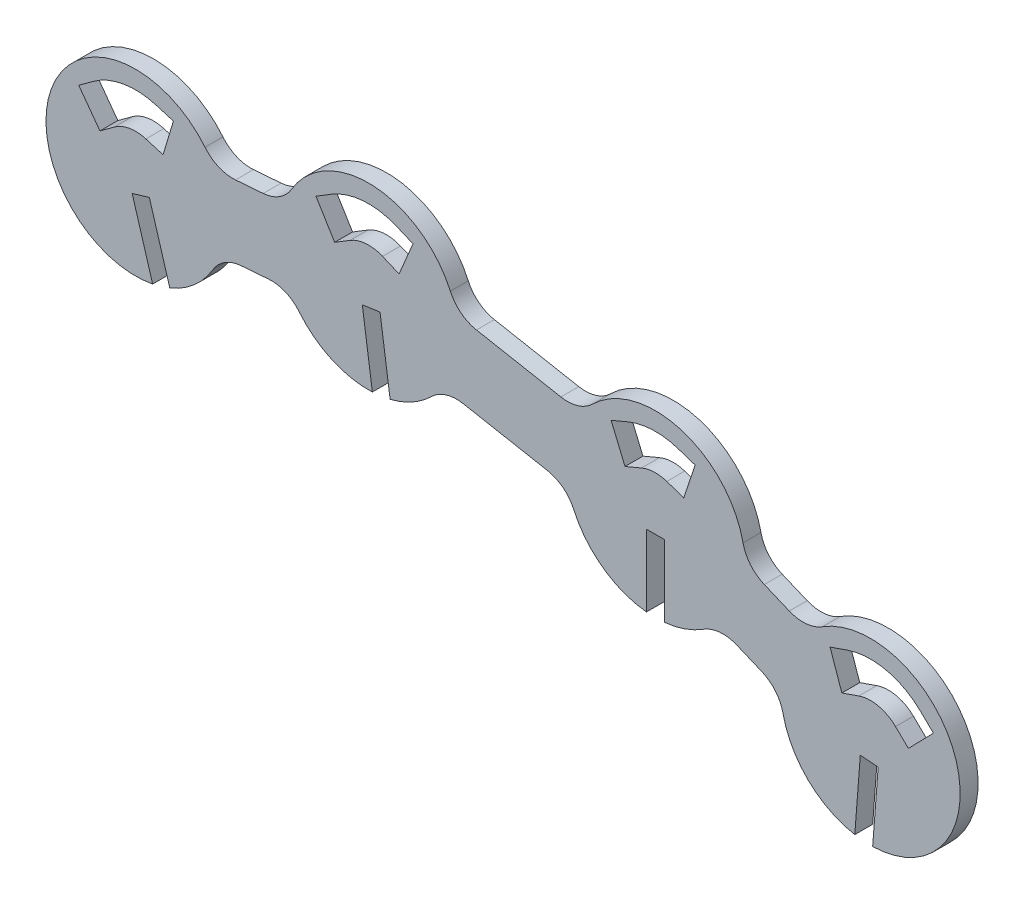
from build123d import *

# Parameters (mm, degrees)
BOSS_EXTRUDE1_DEPTH = 1.5875
FILLET1_R           = 3.175


with BuildPart() as part:
    # Sketch4 → Boss-Extrude1 (new body)
    with BuildSketch(Plane.XY):
        with BuildLine():
            Line((100.453077844, 80.395193317), (94.322399388, 79.923602666))
            ThreePointArc((94.322399388, 79.923602666), (80.150110348, 79.621122729), (88.821616455, 68.40728072))
            Line((88.821616455, 68.40728072), (87.008390154, 74.451368388))
            Line((87.008390154, 74.451368388), (87.768664768, 74.679450772))
            Line((87.768664768, 74.679450772), (88.528939382, 74.907533156))
            Line((88.528939382, 74.907533156), (90.342165683, 68.863445488))
            ThreePointArc((90.342165683, 68.863445488), (93.082490895, 70.749210028), (94.809422156, 73.592306683))
            Line((94.809422156, 73.592306683), (100.940100612, 74.063897334))
            ThreePointArc((100.940100612, 74.063897334), (104.003334801, 70.900719906), (108.281132842, 69.856910029))
            Line((108.281132842, 69.856910029), (107.388733992, 76.103701977))
            Line((107.388733992, 76.103701977), (108.174506403, 76.215955179))
            Line((108.174506403, 76.215955179), (108.960278814, 76.32820838))
            Line((108.960278814, 76.32820838), (109.852677663, 70.081416432))
            ThreePointArc((109.852677663, 70.081416432), (112.484101458, 71.272453552), (114.515120736, 73.3262114))
            Line((114.515120736, 73.3262114), (125.614647067, 71.245050213))
            ThreePointArc((125.614647067, 71.245050213), (128.101842683, 67.070106968), (132.55625, 65.127287218))
            Line((132.55625, 65.127287218), (132.55625, 71.477287218))
            Line((132.55625, 71.477287218), (133.35, 71.477287218))
            Line((133.35, 71.477287218), (134.14375, 71.477287218))
            Line((134.14375, 71.477287218), (134.14375, 65.127287218))
            ThreePointArc((134.14375, 65.127287218), (136.675698551, 65.817806691), (138.844082076, 67.296215802))
            Line((138.844082076, 67.296215802), (144.463610232, 64.954745737))
            ThreePointArc((144.463610232, 64.954745737), (146.356207306, 59.941970278), (151.002861083, 57.273927891))
            Line((151.002861083, 57.273927891), (151.48988385, 63.605223874))
            Line((151.48988385, 63.605223874), (152.281295848, 63.544346028))
            Line((152.281295848, 63.544346028), (153.072707846, 63.483468182))
            Line((153.072707846, 63.483468182), (152.585685078, 57.152172199))
            ThreePointArc((152.585685078, 57.152172199), (159.729512866, 68.134161681), (146.905917924, 70.816284198))
            Line((146.905917924, 70.816284198), (141.286389768, 73.157754263))
            ThreePointArc((141.286389768, 73.157754263), (135.620274668, 80.630902917), (126.784879264, 77.4862886))
            Line((126.784879264, 77.4862886), (115.685352934, 79.567449787))
            ThreePointArc((115.685352934, 79.567449787), (108.380699601, 85.713306212), (100.453077844, 80.395193317))
        make_face()
        with BuildLine():
            ThreePointArc((134.354023157, 76.037069471), (133.228154551, 76.197661136), (132.117919025, 75.951192316))
            Line((132.117919025, 75.951192316), (130.654822867, 75.335151828))
            Line((130.654822867, 75.335151828), (129.422741892, 78.261344145))
            Line((129.422741892, 78.261344145), (130.88583805, 78.877384632))
            ThreePointArc((130.88583805, 78.877384632), (133.106309101, 79.370322273), (135.358046314, 79.049138943))
            Line((135.358046314, 79.049138943), (136.86408105, 78.547127364))
            Line((136.86408105, 78.547127364), (135.860057893, 75.535057893))
            Line((135.860057893, 75.535057893), (134.354023157, 76.037069471))
        make_face(mode=Mode.SUBTRACT)
        with BuildLine():
            ThreePointArc((83.557340736, 81.320671724), (86.234149214, 82.457767939), (89.137159073, 82.282196911))
            Line((89.137159073, 82.282196911), (90.657708301, 81.826032143))
            Line((90.657708301, 81.826032143), (89.745378764, 78.784933687))
            Line((89.745378764, 78.784933687), (88.224829537, 79.241098456))
            ThreePointArc((88.224829537, 79.241098456), (86.773324607, 79.32888397), (85.434920368, 78.760335862))
            Line((85.434920368, 78.760335862), (84.154752437, 77.821546046))
            Line((84.154752437, 77.821546046), (82.277172805, 80.381881908))
            Line((82.277172805, 80.381881908), (83.557340736, 81.320671724))
        make_face(mode=Mode.SUBTRACT)
        with BuildLine():
            ThreePointArc((109.182080975, 80.713692316), (107.712055506, 80.953571291), (106.29439622, 80.496669822))
            Line((106.29439622, 80.496669822), (104.939811309, 79.668867932))
            Line((104.939811309, 79.668867932), (103.284207529, 82.378037754))
            Line((103.284207529, 82.378037754), (104.63879244, 83.205839644))
            ThreePointArc((104.63879244, 83.205839644), (107.474111012, 84.119642581), (110.41416195, 83.639884632))
            Line((110.41416195, 83.639884632), (111.877258108, 83.023844145))
            Line((111.877258108, 83.023844145), (110.645177133, 80.097651828))
            Line((110.645177133, 80.097651828), (109.182080975, 80.713692316))
        make_face(mode=Mode.SUBTRACT)
        with BuildLine():
            ThreePointArc((154.612294548, 67.364862034), (153.086943568, 68.187295725), (151.356947016, 68.08627733))
            Line((151.356947016, 68.08627733), (149.857558351, 67.564750837))
            Line((149.857558351, 67.564750837), (148.814505367, 70.563528167))
            Line((148.814505367, 70.563528167), (150.313894032, 71.085054659))
            ThreePointArc((150.313894032, 71.085054659), (153.773887136, 71.287091449), (156.824589095, 69.642224068))
            Line((156.824589095, 69.642224068), (157.963270112, 68.536076795))
            Line((157.963270112, 68.536076795), (155.750975565, 66.25871476))
            Line((155.750975565, 66.25871476), (154.612294548, 67.364862034))
        make_face(mode=Mode.SUBTRACT)
    extrude(amount=BOSS_EXTRUDE1_DEPTH)

    # Fillet1
    fillet1_edges = [part.edges().sort_by_distance(p)[0] for p in [
        (94.322399388, 79.923602666, 0.79375),
        (100.453077844, 80.395193317, 0.79375),
        (115.685352934, 79.567449787, 0.79375),
        (126.784879264, 77.4862886, 0.79375),
        (141.286389768, 73.157754263, 0.79375),
        (146.905917924, 70.816284198, 0.79375),
        (144.463610232, 64.954745737, 0.79375),
        (138.844082076, 67.296215802, 0.79375),
        (125.614647067, 71.245050213, 0.79375),
        (114.515120736, 73.3262114, 0.79375),
        (100.940100612, 74.063897334, 0.79375),
        (94.809422156, 73.592306683, 0.79375),
    ]]
    fillet(fillet1_edges, radius=FILLET1_R)


solid = part.part
